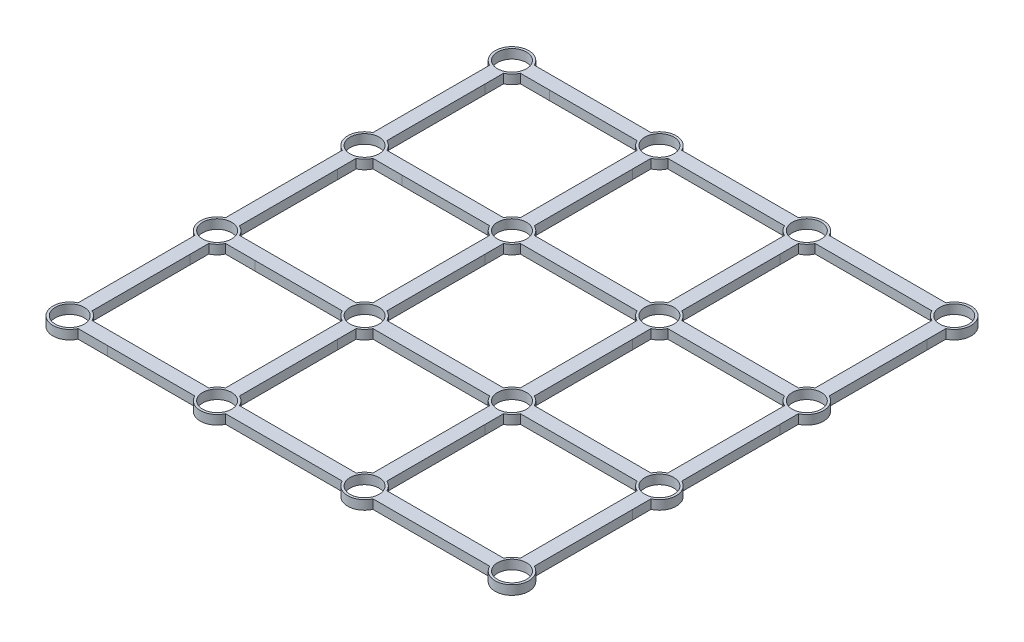
from build123d import *

# Parameters (mm, degrees)
SKETCH1_R           = 2.500002808
SKETCH1_R_2         = 2.50000166
SKETCH1_R_3         = 2.49999759
SKETCH1_R_4         = 2.497835615
SKETCH1_R_5         = 2.500025393
SKETCH1_R_6         = 2.500025394
SKETCH1_R_7         = 2.499109112
SKETCH1_R_8         = 2.500022031
SKETCH1_R_9         = 2.500032118
SKETCH1_R_10        = 2.500032105
SKETCH1_R_11        = 2.500335806
SKETCH1_R_12        = 2.500372349
SKETCH1_R_13        = 2.500035476
SKETCH1_R_14        = 2.500045579
SKETCH1_R_15        = 2.499458373
BOSS_EXTRUDE2_DEPTH = 1.5875


with BuildPart() as part:
    # Sketch1 → Boss-Extrude2 (new body)
    with BuildSketch(Plane(origin=(0, 0, 0), x_dir=(1, 0, 0), z_dir=(0, 1, 0))):
        with BuildLine():
            Line((-30.419419865, 39.300031508), (-35.459525271, 39.29910902))
            ThreePointArc((-35.459525271, 39.29910902), (-40.151348366, 40.151890718), (-39.299271564, 35.459939558))
            Line((-39.299271564, 35.459939558), (-39.30133012, 32.246625564))
            Line((-39.30133012, 32.246625564), (-39.30133012, 15.339566081))
            ThreePointArc((-39.30133012, 15.339566081), (-40.999878599, 12.699074766), (-39.299271586, 10.059908779))
            Line((-39.299271586, 10.059908779), (-39.30133012, 6.846628747))
            Line((-39.30133012, 6.846628747), (-39.30133012, -10.060434088))
            ThreePointArc((-39.30133012, -10.060434088), (-41.000493881, -12.701259465), (-39.299272016, -15.340759479))
            Line((-39.299272016, -15.340759479), (-39.30133012, -18.553368071))
            Line((-39.30133012, -18.553368071), (-39.30133012, -35.460705386))
            ThreePointArc((-39.30133012, -35.460705386), (-40.146387648, -40.147846532), (-35.459924182, -39.299038825))
            Line((-35.459924182, -39.299038825), (-30.419419865, -39.299958425))
            Line((-30.419419865, -39.299958425), (-15.340359929, -39.299958542))
            ThreePointArc((-15.340359929, -39.299958542), (-12.699987861, -41.000143179), (-10.059597044, -39.299987658))
            Line((-10.059597044, -39.299987658), (10.059653302, -39.299987658))
            ThreePointArc((10.059653302, -39.299987658), (12.700028129, -41.000143181), (15.340402956, -39.299987658))
            Line((15.340402956, -39.299987658), (35.459929432, -39.299987658))
            ThreePointArc((35.459929432, -39.299987658), (40.149969295, -40.150524197), (39.301349862, -35.460137072))
            Line((39.301349862, -35.460137072), (39.301349862, -18.553368071))
            Line((39.301349862, -18.553368071), (39.300291546, -15.339006013))
            ThreePointArc((39.300291546, -15.339006013), (40.99964872, -12.6998056), (39.301349862, -10.059924047))
            Line((39.301349862, -10.059924047), (39.301349862, 6.846628747))
            Line((39.301349862, 6.846628747), (39.300292156, 10.059138587))
            ThreePointArc((39.300292156, 10.059138587), (41.000710133, 12.699266691), (39.301349862, 15.340075727))
            Line((39.301349862, 15.340075727), (39.301349862, 32.246625564))
            Line((39.301349862, 32.246625564), (39.300291953, 35.459752308))
            ThreePointArc((39.300291953, 35.459752308), (40.150673607, 40.150508157), (35.459924244, 39.300090729))
            Line((35.459924244, 39.300090729), (15.34013324, 39.300090728))
            ThreePointArc((15.34013324, 39.300090728), (12.700028743, 41.000175545), (10.059924246, 39.300090728))
            Line((10.059924246, 39.300090728), (-10.059924382, 39.300090728))
            ThreePointArc((-10.059924382, 39.300090728), (-12.699947344, 40.999998537), (-15.339932068, 39.300031345))
            Line((-15.339932068, 39.300031345), (-30.419419865, 39.300031508))
        make_face()
        with Locations(Location((-12.699994007, -12.699967282, 0), (0, 0, 270))):
            Circle(SKETCH1_R, mode=Mode.SUBTRACT)
        with Locations(Location((12.699997616, -12.699984715, 0), (0, 0, 270))):
            Circle(SKETCH1_R_2, mode=Mode.SUBTRACT)
        with Locations(Location((38.099651447, -12.699224227, 0), (0, 0, 270))):
            Circle(SKETCH1_R_3, mode=Mode.SUBTRACT)
        with Locations(Location((38.100105251, -38.09746951, 0), (0, 0, 270))):
            Circle(SKETCH1_R_4, mode=Mode.SUBTRACT)
        with Locations(Location((12.700028129, -38.099788509, 0), (0, 0, 270))):
            Circle(SKETCH1_R_5, mode=Mode.SUBTRACT)
        with Locations(Location((-12.699971869, -38.099788508, 0), (0, 0, 270))):
            Circle(SKETCH1_R_6, mode=Mode.SUBTRACT)
        with Locations(Location((-38.097650594, -38.09746951, 0), (0, 0, 270))):
            Circle(SKETCH1_R_7, mode=Mode.SUBTRACT)
        with Locations(Location((-38.099964239, 12.70020544, 0), (0, 0, 270))):
            Circle(SKETCH1_R_8, mode=Mode.SUBTRACT)
        with Locations(Location((-12.699971229, 12.700197776, 0), (0, 0, 270))):
            Circle(SKETCH1_R_9, mode=Mode.SUBTRACT)
        with Locations(Location((12.700028748, 12.700197797, 0), (0, 0, 270))):
            Circle(SKETCH1_R_10, mode=Mode.SUBTRACT)
        with Locations(Location((38.100021741, 12.699847663, 0), (0, 0, 270))):
            Circle(SKETCH1_R_11, mode=Mode.SUBTRACT)
        with Locations(Location((38.100105251, 38.099924155, 0), (0, 0, 270))):
            Circle(SKETCH1_R_12, mode=Mode.SUBTRACT)
        with Locations(Location((12.700028743, 38.100190778, 0), (0, 0, 270))):
            Circle(SKETCH1_R_13, mode=Mode.SUBTRACT)
        with Locations(Location((-12.699914729, 38.1000661, 0), (0, 0, 270))):
            Circle(SKETCH1_R_14, mode=Mode.SUBTRACT)
        with Locations(Location((-38.098537562, 38.098771619, 0), (0, 0, 270))):
            Circle(SKETCH1_R_15, mode=Mode.SUBTRACT)
        with BuildLine():
            Line((15.340070501, -11.499983563), (35.459578124, -11.499225323))
            ThreePointArc((35.459578124, -11.499225323), (36.048662043, -10.648998145), (36.89866988, -10.059597777))
            Line((36.89866988, -10.059597777), (36.89866988, 6.846628039))
            Line((36.89866988, 6.846628039), (36.899895717, 10.059072962))
            ThreePointArc((36.899895717, 10.059072962), (36.048812378, 10.648864083), (35.459114947, 11.500012341))
            Line((35.459114947, 11.500012341), (15.340020191, 11.500012341))
            ThreePointArc((15.340020191, 11.500012341), (14.750277935, 10.649227729), (13.899286055, 10.059784598))
            Line((13.899286055, 10.059784598), (13.901349862, 6.846628763))
            Line((13.901349862, 6.846628763), (13.901349862, -10.060526365))
            ThreePointArc((13.901349862, -10.060526365), (14.751130478, -10.649901403), (15.340070501, -11.499983563))
        make_face(mode=Mode.SUBTRACT)
        with BuildLine():
            Line((-13.90133012, 32.246625556), (-13.899271671, 35.459772354))
            ThreePointArc((-13.899271671, 35.459772354), (-14.750217307, 36.049244928), (-15.339905069, 36.900041457))
            Line((-15.339905069, 36.900041457), (-30.419419865, 36.900041574))
            Line((-30.419419865, 36.900041574), (-35.460354422, 36.900961253))
            ThreePointArc((-35.460354422, 36.900961253), (-36.04992056, 36.050164545), (-36.900714467, 35.460594368))
            Line((-36.900714467, 35.460594368), (-36.898650138, 32.246625564))
            Line((-36.898650138, 32.246625564), (-36.898650138, 15.339589649))
            ThreePointArc((-36.898650138, 15.339589649), (-36.048479013, 14.749818316), (-35.459484214, 13.899109028))
            Line((-35.459484214, 13.899109028), (-30.419419865, 13.900031509))
            Line((-30.419419865, 13.900031509), (-15.340122622, 13.900031345))
            ThreePointArc((-15.340122622, 13.900031345), (-14.751173243, 14.750214914), (-13.90133012, 15.339655445))
            Line((-13.90133012, 15.339655445), (-13.90133012, 32.246625556))
        make_face(mode=Mode.SUBTRACT)
        with BuildLine():
            Line((-11.498650138, 32.246625573), (-11.500713894, 35.459701448))
            ThreePointArc((-11.500713894, 35.459701448), (-10.649684088, 36.049173012), (-10.059937624, 36.900012341))
            Line((-10.059937624, 36.900012341), (10.060050834, 36.900012341))
            ThreePointArc((10.060050834, 36.900012341), (10.649770864, 36.049250927), (11.500728355, 35.459813869))
            Line((11.500728355, 35.459813869), (11.49866988, 32.246625549))
            Line((11.49866988, 32.246625549), (11.49866988, 15.339655472))
            ThreePointArc((11.49866988, 15.339655472), (10.648849792, 14.750238001), (10.059904338, 13.900090728))
            Line((10.059904338, 13.900090728), (-10.059846824, 13.900090728))
            ThreePointArc((-10.059846824, 13.900090728), (-10.648806949, 14.75025267), (-11.498650138, 15.339672649))
            Line((-11.498650138, 15.339672649), (-11.498650138, 32.246625573))
        make_face(mode=Mode.SUBTRACT)
        with BuildLine():
            Line((13.901349862, 32.246625581), (13.899286047, 35.4597943))
            ThreePointArc((13.899286047, 35.4597943), (14.750269889, 36.0492342), (15.340006653, 36.900012341))
            Line((15.340006653, 36.900012341), (35.45970754, 36.900012341))
            ThreePointArc((35.45970754, 36.900012341), (36.04919153, 36.049241502), (36.899895943, 35.459661655))
            Line((36.899895943, 35.459661655), (36.89866988, 32.246624857))
            Line((36.89866988, 32.246624857), (36.89866988, 15.340064926))
            ThreePointArc((36.89866988, 15.340064926), (36.04849466, 14.75051344), (35.459300234, 13.900090728))
            Line((35.459300234, 13.900090728), (15.340153158, 13.900090728))
            ThreePointArc((15.340153158, 13.900090728), (14.751193042, 14.750252671), (13.901349862, 15.339672655))
            Line((13.901349862, 15.339672655), (13.901349862, 32.246625581))
        make_face(mode=Mode.SUBTRACT)
        with BuildLine():
            Line((-30.419419865, 11.500041575), (-35.459638949, 11.500961122))
            ThreePointArc((-35.459638949, 11.500961122), (-36.049412678, 10.649658472), (-36.900714008, 10.059882836))
            Line((-36.900714008, 10.059882836), (-36.898650138, 6.846628747))
            Line((-36.898650138, 6.846628747), (-36.898650138, -10.060893627))
            ThreePointArc((-36.898650138, -10.060893627), (-36.048873684, -10.650532787), (-35.460073943, -11.50089108))
            Line((-35.460073943, -11.50089108), (-30.419419865, -11.499968491))
            Line((-30.419419865, -11.499968491), (-15.340064434, -11.499968655))
            ThreePointArc((-15.340064434, -11.499968655), (-14.751119263, -10.649881004), (-13.90133012, -10.060505196))
            Line((-13.90133012, -10.060505196), (-13.90133012, 6.846628738))
            Line((-13.90133012, 6.846628738), (-13.899271653, 10.059804156))
            ThreePointArc((-13.899271653, 10.059804156), (-14.750248483, 10.649255759), (-15.339975923, 11.500041457))
            Line((-15.339975923, 11.500041457), (-30.419419865, 11.500041575))
        make_face(mode=Mode.SUBTRACT)
        with BuildLine():
            Line((-10.059979771, 11.500012342), (10.060037304, 11.500012342))
            ThreePointArc((10.060037304, 11.500012342), (10.649762824, 10.64924446), (11.500728347, 10.059804171))
            Line((11.500728347, 10.059804171), (11.49866988, 6.846628731))
            Line((11.49866988, 6.846628731), (11.49866988, -10.060515209))
            ThreePointArc((11.49866988, -10.060515209), (10.648903118, -10.649863021), (10.059958501, -11.499909271))
            Line((10.059958501, -11.499909271), (-10.059950574, -11.499909271))
            ThreePointArc((-10.059950574, -11.499909271), (-10.648888796, -10.64986095), (-11.498650138, -10.060508726))
            Line((-11.498650138, -10.060508726), (-11.498650138, 6.846628755))
            Line((-11.498650138, 6.846628755), (-11.500713945, 10.059784562))
            ThreePointArc((-11.500713945, 10.059784562), (-10.649722039, 10.649227704), (-10.059979771, 11.500012342))
        make_face(mode=Mode.SUBTRACT)
        with BuildLine():
            Line((-30.419419865, -13.899958425), (-35.459924827, -13.899038825))
            ThreePointArc((-35.459924827, -13.899038825), (-36.049547549, -14.750399797), (-36.900713887, -15.340303455))
            Line((-36.900713887, -15.340303455), (-36.898650138, -18.553368071))
            Line((-36.898650138, -18.553368071), (-36.898650138, -35.45857441))
            ThreePointArc((-36.898650138, -35.45857441), (-36.047153416, -36.048852717), (-35.457656571, -36.900890637))
            Line((-35.457656571, -36.900890637), (-30.419419865, -36.899968491))
            Line((-30.419419865, -36.899968491), (-15.340519074, -36.899968654))
            ThreePointArc((-15.340519074, -36.899968654), (-14.751429739, -36.049525639), (-13.90133012, -35.459940866))
            Line((-13.90133012, -35.459940866), (-13.90133012, -18.553368079))
            Line((-13.90133012, -18.553368079), (-13.899271763, -15.34036525))
            ThreePointArc((-13.899271763, -15.34036525), (-14.750322741, -14.750850177), (-15.340067783, -13.899958542))
            Line((-15.340067783, -13.899958542), (-30.419419865, -13.899958425))
        make_face(mode=Mode.SUBTRACT)
        with BuildLine():
            Line((-10.059933466, -13.899987658), (10.059925546, -13.899987658))
            ThreePointArc((10.059925546, -13.899987658), (10.649674346, -14.750877713), (11.500728221, -15.340390085))
            Line((11.500728221, -15.340390085), (11.49866988, -18.553368087))
            Line((11.49866988, -18.553368087), (11.49866988, -35.459940866))
            ThreePointArc((11.49866988, -35.459940866), (10.648593315, -36.049502572), (10.059507908, -36.899909271))
            Line((10.059507908, -36.899909271), (-10.059451649, -36.899909271))
            ThreePointArc((-10.059451649, -36.899909271), (-10.648551236, -36.049488382), (-11.498650138, -35.459924247))
            Line((-11.498650138, -35.459924247), (-11.498650138, -18.553368063))
            Line((-11.498650138, -18.553368063), (-11.500713848, -15.340364158))
            ThreePointArc((-11.500713848, -15.340364158), (-10.649675649, -14.750860549), (-10.059933466, -13.899987658))
        make_face(mode=Mode.SUBTRACT)
        with BuildLine():
            Line((15.340069687, -13.899987659), (35.45992576, -13.899987659))
            ThreePointArc((35.45992576, -13.899987659), (36.049435301, -14.750223563), (36.899896296, -15.33940833))
            Line((36.899896296, -15.33940833), (36.89866988, -18.553368779))
            Line((36.89866988, -18.553368779), (36.89866988, -35.45992785))
            ThreePointArc((36.89866988, -35.45992785), (36.048580337, -36.049479825), (35.459518782, -36.899909271))
            Line((35.459518782, -36.899909271), (15.340548351, -36.899909271))
            ThreePointArc((15.340548351, -36.899909271), (14.751448763, -36.049488383), (13.901349862, -35.459924248))
            Line((13.901349862, -35.459924248), (13.901349862, -18.553368055))
            Line((13.901349862, -18.553368055), (13.899286163, -15.340381387))
            ThreePointArc((13.899286163, -15.340381387), (14.750328324, -14.750870278), (15.340069687, -13.899987659))
        make_face(mode=Mode.SUBTRACT)
        with BuildLine():
            ThreePointArc((-39.300495921, -10.506957748), (-40.600495568, -12.700129175), (-39.300495855, -14.893300563))
            ThreePointArc((-39.300495855, -14.893300563), (-35.600494344, -12.7001291), (-39.300495921, -10.506957748))
        make_face(mode=Mode.SUBTRACT)
    extrude(amount=BOSS_EXTRUDE2_DEPTH)


solid = part.part
